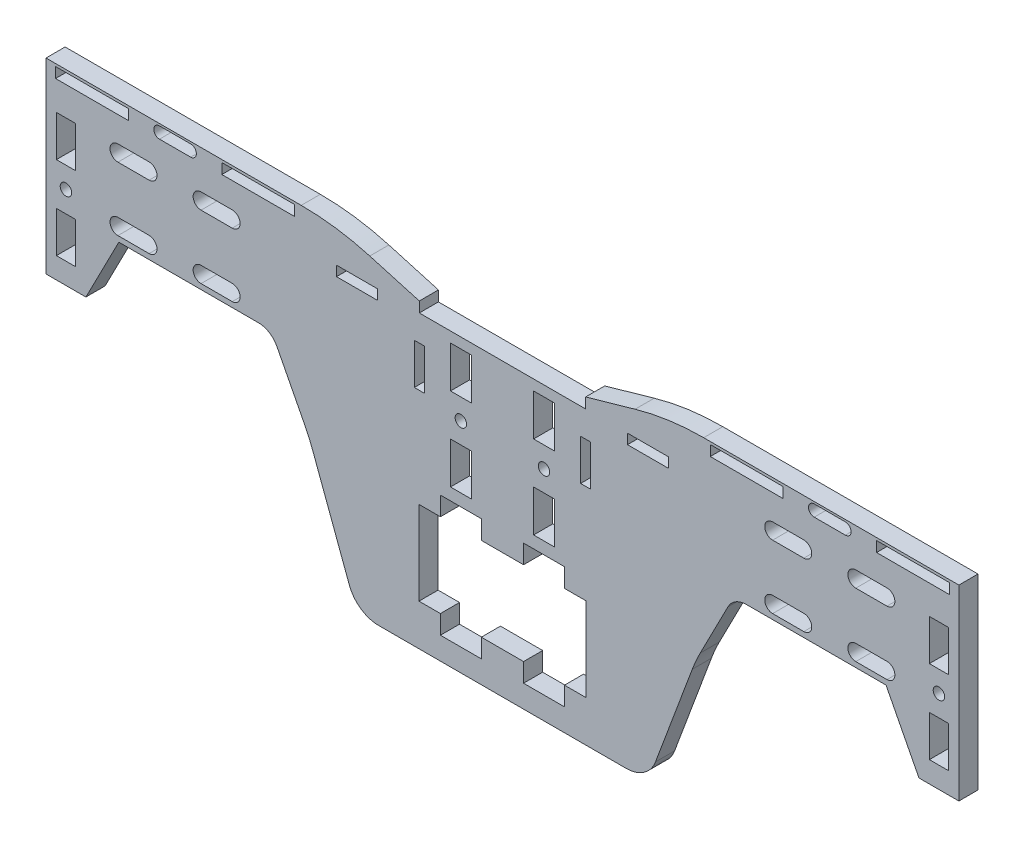
from build123d import *

# Parameters (mm, degrees)
SKETCH1_R           = 1.7526
SKETCH1_W           = 9.525
SKETCH1_H           = 11.684
SKETCH1_W_2         = 6.35
SKETCH1_H_2         = 12.7
SKETCH1_W_3         = 5.741999946
SKETCH1_H_3         = 12.5
SKETCH1_W_4         = 5.842
SKETCH1_W_5         = 12.7
SKETCH1_H_4         = 5.842
BOSS_EXTRUDE1_DEPTH = 5.842
FILLET1_R           = 6.35
FILLET2_R           = 9.525
FILLET4_R           = 76.2
FILLET5_R           = 50.8
SKETCH2_W           = 9.525
SKETCH2_H           = 37.084
BOSS_EXTRUDE2_DEPTH = 5.842
SKETCH3_W           = 39.726031453
SKETCH3_H           = 13.117085857
BOSS_EXTRUDE3_DEPTH = 5.842
SKETCH4_W           = 12.5
SKETCH4_H           = 3.048
SKETCH4_W_2         = 3.048
SKETCH4_H_2         = 12.5
CUT_EXTRUDE1_DEPTH  = 158.941724336


with BuildPart() as part:
    # Sketch1 → Boss-Extrude1 (new body)
    with BuildSketch(Plane.XY):
        Polygon((25.4, 63.5), (-25.4, 63.5), (-25.4, 66.675), (-50.8, 73.9342438), (-139.446, 73.9342438), (-139.446, 16.7842438), (-127.254, 16.7842438), (-117.187573781, 36.3358938), (-70.673088246, 36.3358938), (-59.046135547, 13.75329052), (-44.45, -25.4), (44.45, -25.4), (59.046135547, 13.75329052), (70.673088246, 36.3358938), (117.187573781, 36.3358938), (127.254, 16.7842438), (139.446, 16.7842438), (139.446, 73.9342438), (50.8, 73.9342438), (25.4, 66.675), align=None)
        with Locations((28.370999973, 38.1)):
            Circle(SKETCH1_R, mode=Mode.SUBTRACT)
        with Locations(Location((-28.370999973, 38.1, 0), (0, 0, 180))):
            Circle(SKETCH1_R, mode=Mode.SUBTRACT)
        with Locations((-12.7, 41.275)):
            Circle(SKETCH1_R, mode=Mode.SUBTRACT)
        with Locations(Location((12.7, 41.275, 0), (0, 0, 180))):
            Circle(SKETCH1_R, mode=Mode.SUBTRACT)
        with Locations((-72.516999946, 50.7499874)):
            Circle(SKETCH1_R, mode=Mode.SUBTRACT)
        with Locations(Location((-40.766999946, 50.7499874, 0), (0, 0, 180))):
            Circle(SKETCH1_R, mode=Mode.SUBTRACT)
        with Locations((40.766999946, 50.7499874)):
            Circle(SKETCH1_R, mode=Mode.SUBTRACT)
        with Locations(Location((72.516999946, 50.7499874, 0), (0, 0, 180))):
            Circle(SKETCH1_R, mode=Mode.SUBTRACT)
        with Locations((133.35, 42.1842438)):
            Circle(SKETCH1_R, mode=Mode.SUBTRACT)
        with Locations(Location((-133.35, 42.1842438, 0), (0, 0, 180))):
            Circle(SKETCH1_R, mode=Mode.SUBTRACT)
        Polygon((25.5, -12.8), (18.95, -12.8), (18.95, -18.542), (6.45, -18.542), (6.45, -12.8), (-6.45, -12.8), (-6.45, -18.542), (-18.95, -18.542), (-18.95, -12.8), (-25.5, -12.8), (-25.5, -6.25), (-31.241999946, -6.25), (-31.241999946, 6.25), (-25.5, 6.25), (-25.5, 12.8), (-18.95, 12.8), (-18.95, 18.542), (-6.45, 18.542), (-6.45, 12.8), (6.45, 12.8), (6.45, 18.542), (18.95, 18.542), (18.95, 12.8), (25.5, 12.8), (25.5, 6.25), (31.241999946, 6.25), (31.241999946, -6.25), (25.5, -6.25), align=None, mode=Mode.SUBTRACT)
        with Locations((39.6875, 12.7)):
            Rectangle(SKETCH1_W, SKETCH1_H, mode=Mode.SUBTRACT)
        with Locations((39.6875, -12.7)):
            Rectangle(SKETCH1_W, SKETCH1_H, mode=Mode.SUBTRACT)
        with Locations((-39.6875, -12.7)):
            Rectangle(SKETCH1_W, SKETCH1_H, mode=Mode.SUBTRACT)
        with Locations((-39.6875, 12.7)):
            Rectangle(SKETCH1_W, SKETCH1_H, mode=Mode.SUBTRACT)
        with Locations((-12.7, 28.575)):
            Rectangle(SKETCH1_W_2, SKETCH1_H_2, mode=Mode.SUBTRACT)
        with Locations((-12.7, 53.975)):
            Rectangle(SKETCH1_W_2, SKETCH1_H_2, mode=Mode.SUBTRACT)
        with BuildLine():
            Line((82.55, 62.1930938), (92.075, 62.1930938))
            ThreePointArc((92.075, 62.1930938), (94.488, 59.7800938), (92.075, 57.3670938))
            Line((92.075, 57.3670938), (82.55, 57.3670938))
            ThreePointArc((82.55, 57.3670938), (80.137, 59.7800938), (82.55, 62.1930938))
        make_face(mode=Mode.SUBTRACT)
        with BuildLine():
            Line((82.55, 42.7620938), (92.075, 42.7620938))
            ThreePointArc((92.075, 42.7620938), (94.488, 40.3490938), (92.075, 37.9360938))
            Line((92.075, 37.9360938), (82.55, 37.9360938))
            ThreePointArc((82.55, 37.9360938), (80.137, 40.3490938), (82.55, 42.7620938))
        make_face(mode=Mode.SUBTRACT)
        with BuildLine():
            Line((107.95, 62.1930938), (117.475, 62.1930938))
            ThreePointArc((117.475, 62.1930938), (119.888, 59.7800938), (117.475, 57.3670938))
            Line((117.475, 57.3670938), (107.95, 57.3670938))
            ThreePointArc((107.95, 57.3670938), (105.537, 59.7800938), (107.95, 62.1930938))
        make_face(mode=Mode.SUBTRACT)
        with BuildLine():
            Line((107.95, 42.7620938), (117.475, 42.7620938))
            ThreePointArc((117.475, 42.7620938), (119.888, 40.3490938), (117.475, 37.9360938))
            Line((117.475, 37.9360938), (107.95, 37.9360938))
            ThreePointArc((107.95, 37.9360938), (105.537, 40.3490938), (107.95, 42.7620938))
        make_face(mode=Mode.SUBTRACT)
        Polygon((63.5, 73.1404938), (76.2, 73.1404938), (85.725, 73.1404938), (85.725, 69.9654938), (76.2, 69.9654938), (63.5, 69.9654938), align=None, mode=Mode.SUBTRACT)
        Polygon((114.3, 73.1404938), (127, 73.1404938), (136.525, 73.1404938), (136.525, 69.9654938), (127, 69.9654938), (114.3, 69.9654938), align=None, mode=Mode.SUBTRACT)
        with Locations((-28.370999973, 50.8)):
            Rectangle(SKETCH1_W_3, SKETCH1_H_3, mode=Mode.SUBTRACT)
        with Locations((-28.370999973, 25.4)):
            Rectangle(SKETCH1_W_3, SKETCH1_H_3, mode=Mode.SUBTRACT)
        with Locations((28.370999973, 50.8)):
            Rectangle(SKETCH1_W_3, SKETCH1_H_3, mode=Mode.SUBTRACT)
        with Locations((28.370999973, 25.4)):
            Rectangle(SKETCH1_W_3, SKETCH1_H_3, mode=Mode.SUBTRACT)
        with Locations((133.35, 29.4842438)):
            Rectangle(SKETCH1_W_4, SKETCH1_H_3, mode=Mode.SUBTRACT)
        with Locations((133.35, 54.8842438)):
            Rectangle(SKETCH1_W_4, SKETCH1_H_3, mode=Mode.SUBTRACT)
        Polygon((-127, 69.9654938), (-136.525, 69.9654938), (-136.525, 73.1404938), (-127, 73.1404938), (-114.3, 73.1404938), (-114.3, 69.9654938), align=None, mode=Mode.SUBTRACT)
        Polygon((-85.725, 73.1404938), (-85.725, 69.9654938), (-76.2, 69.9654938), (-63.5, 69.9654938), (-63.5, 73.1404938), (-76.2, 73.1404938), align=None, mode=Mode.SUBTRACT)
        with BuildLine():
            Line((-107.95, 42.7620938), (-117.475, 42.7620938))
            ThreePointArc((-117.475, 42.7620938), (-119.888, 40.3490938), (-117.475, 37.9360938))
            Line((-117.475, 37.9360938), (-107.95, 37.9360938))
            ThreePointArc((-107.95, 37.9360938), (-105.537, 40.3490938), (-107.95, 42.7620938))
        make_face(mode=Mode.SUBTRACT)
        with BuildLine():
            Line((-107.95, 62.1930938), (-117.475, 62.1930938))
            ThreePointArc((-117.475, 62.1930938), (-119.888, 59.7800938), (-117.475, 57.3670938))
            Line((-117.475, 57.3670938), (-107.95, 57.3670938))
            ThreePointArc((-107.95, 57.3670938), (-105.537, 59.7800938), (-107.95, 62.1930938))
        make_face(mode=Mode.SUBTRACT)
        with BuildLine():
            Line((-82.55, 42.7620938), (-92.075, 42.7620938))
            ThreePointArc((-92.075, 42.7620938), (-94.488, 40.3490938), (-92.075, 37.9360938))
            Line((-92.075, 37.9360938), (-82.55, 37.9360938))
            ThreePointArc((-82.55, 37.9360938), (-80.137, 40.3490938), (-82.55, 42.7620938))
        make_face(mode=Mode.SUBTRACT)
        with BuildLine():
            Line((-82.55, 62.1930938), (-92.075, 62.1930938))
            ThreePointArc((-92.075, 62.1930938), (-94.488, 59.7800938), (-92.075, 57.3670938))
            Line((-92.075, 57.3670938), (-82.55, 57.3670938))
            ThreePointArc((-82.55, 57.3670938), (-80.137, 59.7800938), (-82.55, 62.1930938))
        make_face(mode=Mode.SUBTRACT)
        with Locations((12.7, 28.575)):
            Rectangle(SKETCH1_W_2, SKETCH1_H_2, mode=Mode.SUBTRACT)
        with Locations((12.7, 53.975)):
            Rectangle(SKETCH1_W_2, SKETCH1_H_2, mode=Mode.SUBTRACT)
        with BuildLine():
            Line((-95.25, 69.8003938), (-104.775, 69.8003938))
            ThreePointArc((-104.775, 69.8003938), (-106.5276, 71.5529938), (-104.775, 73.3055938))
            Line((-104.775, 73.3055938), (-95.25, 73.3055938))
            ThreePointArc((-95.25, 73.3055938), (-93.4974, 71.5529938), (-95.25, 69.8003938))
        make_face(mode=Mode.SUBTRACT)
        with Locations((56.641999946, 50.7499874)):
            Rectangle(SKETCH1_W_5, SKETCH1_H_4, mode=Mode.SUBTRACT)
        with Locations((-56.641999946, 50.7499874)):
            Rectangle(SKETCH1_W_5, SKETCH1_H_4, mode=Mode.SUBTRACT)
        with BuildLine():
            Line((95.25, 69.8003938), (104.775, 69.8003938))
            ThreePointArc((104.775, 69.8003938), (106.5276, 71.5529938), (104.775, 73.3055938))
            Line((104.775, 73.3055938), (95.25, 73.3055938))
            ThreePointArc((95.25, 73.3055938), (93.4974, 71.5529938), (95.25, 69.8003938))
        make_face(mode=Mode.SUBTRACT)
        with Locations((-133.35, 29.4842438)):
            Rectangle(SKETCH1_W_4, SKETCH1_H_3, mode=Mode.SUBTRACT)
        with Locations((-133.35, 54.8842438)):
            Rectangle(SKETCH1_W_4, SKETCH1_H_3, mode=Mode.SUBTRACT)
    extrude(amount=BOSS_EXTRUDE1_DEPTH)

    # Fillet1
    fillet1_edges = [part.edges().sort_by_distance(p)[0] for p in [
        (70.673088246, 36.3358938, 2.921),
        (-70.673088246, 36.3358938, 2.921),
    ]]
    fillet(fillet1_edges, radius=FILLET1_R)

    # Fillet2
    fillet2_edges = [part.edges().sort_by_distance(p)[0] for p in [
        (44.45, -25.4, 2.921),
        (-44.45, -25.4, 2.921),
    ]]
    fillet(fillet2_edges, radius=FILLET2_R)

    # Fillet4
    fillet4_edges = [part.edges().sort_by_distance(p)[0] for p in [
        (50.8, 73.9342438, 2.921),
        (-50.8, 73.9342438, 2.921),
    ]]
    fillet(fillet4_edges, radius=FILLET4_R)

    # Fillet5
    fillet5_edges = [part.edges().sort_by_distance(p)[0] for p in [
        (59.046135547, 13.75329052, 2.921),
        (-59.046135547, 13.75329052, 2.921),
    ]]
    fillet(fillet5_edges, radius=FILLET5_R)

    # Sketch2 → Boss-Extrude2 (add)
    with BuildSketch(Plane.XY.offset(5.842)):
        with Locations((-39.6875, 0)):
            Rectangle(SKETCH2_W, SKETCH2_H)
        with Locations((39.6875, 0)):
            Rectangle(SKETCH2_W, SKETCH2_H)
    extrude(amount=-BOSS_EXTRUDE2_DEPTH)

    # Sketch3 → Boss-Extrude3 (add)
    with BuildSketch(Plane.XY.offset(5.842)):
        with Locations((-57.1552409, 51.348468537)):
            Rectangle(SKETCH3_W, SKETCH3_H)
        Polygon((-31.241999946, 57.05), (-25.5, 57.05), (-25.5, 19.15), (-25.5, -6.25), (-31.241999946, -6.25), (-31.241999946, 19.15), align=None)
        Polygon((25.5, 57.05), (25.5, 19.15), (25.5, -6.25), (31.241999946, -6.25), (31.241999946, 19.15), (31.241999946, 57.05), align=None)
        with Locations((57.1552409, 51.348468537)):
            Rectangle(SKETCH3_W, SKETCH3_H)
    extrude(amount=-BOSS_EXTRUDE3_DEPTH)

    # Sketch4 → Cut-Extrude1 (cut, through all)
    with BuildSketch(Plane.XY.offset(5.842)):
        with Locations((44.45, 61.976)):
            Rectangle(SKETCH4_W, SKETCH4_H)
        with Locations((-44.45, 61.976)):
            Rectangle(SKETCH4_W, SKETCH4_H)
        with Locations((-25.4, 49.276)):
            Rectangle(SKETCH4_W_2, SKETCH4_H_2)
        with Locations((25.4, 49.276)):
            Rectangle(SKETCH4_W_2, SKETCH4_H_2)
    extrude(amount=-CUT_EXTRUDE1_DEPTH, mode=Mode.SUBTRACT)


solid = part.part
